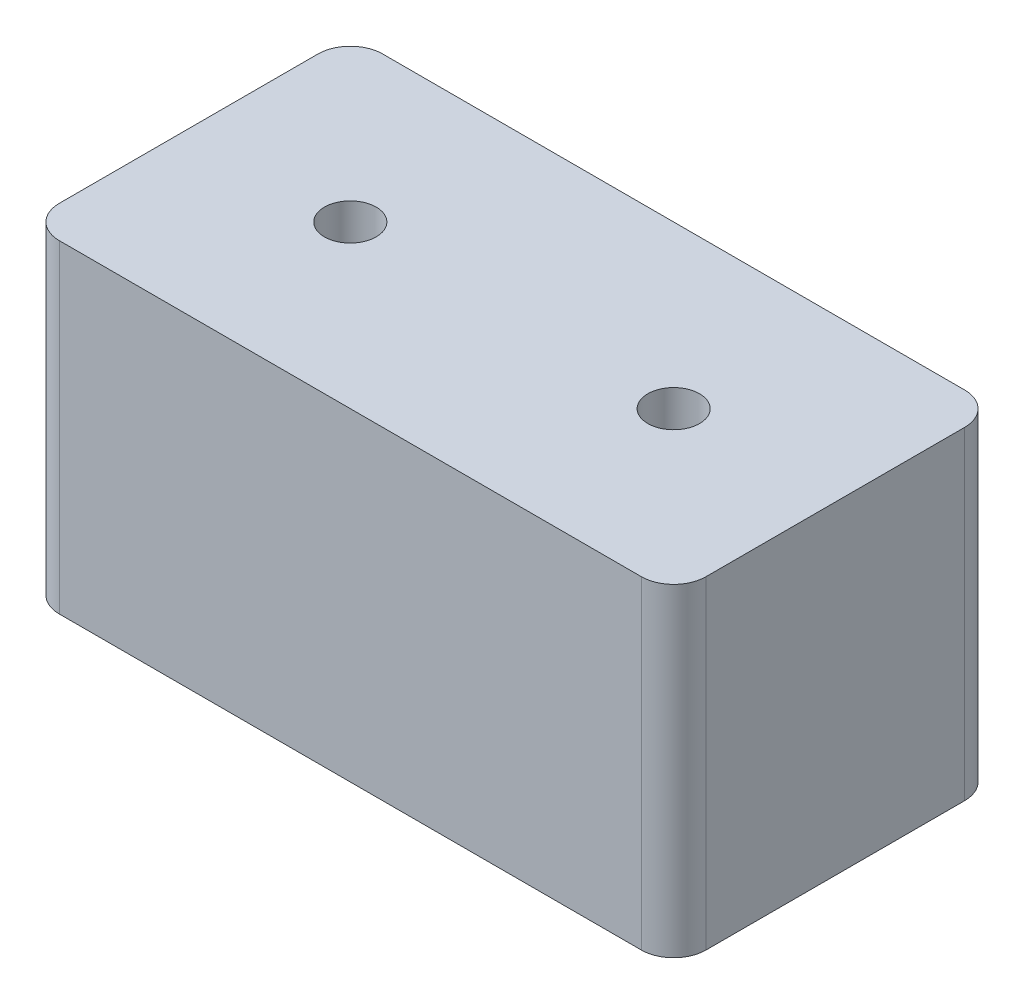
from build123d import *

# Parameters (mm, degrees)
SKETCH1_W           = 40
SKETCH1_H           = 20
SKETCH1_R           = 1.6
BOSS_EXTRUDE1_DEPTH = 20
FILLET1_R           = 2


with BuildPart() as part:
    # Sketch1 → Boss-Extrude1 (new body)
    with BuildSketch(Plane(origin=(0, 0, 0), x_dir=(1, 0, 0), z_dir=(0, 1, 0))):
        with Locations((20, 10)):
            Rectangle(SKETCH1_W, SKETCH1_H)
        with Locations(Location((10, 10, 0), (0, 0, 270))):
            Circle(SKETCH1_R, mode=Mode.SUBTRACT)
        with Locations(Location((30, 10, 0), (0, 0, 270))):
            Circle(SKETCH1_R, mode=Mode.SUBTRACT)
    extrude(amount=BOSS_EXTRUDE1_DEPTH)

    # Fillet1
    fillet1_edges = [part.edges().sort_by_distance(p)[0] for p in [
        (0, 10, -20),
        (40, 10, -20),
        (40, 10, 0),
        (0, 10, 0),
    ]]
    fillet(fillet1_edges, radius=FILLET1_R)


solid = part.part
